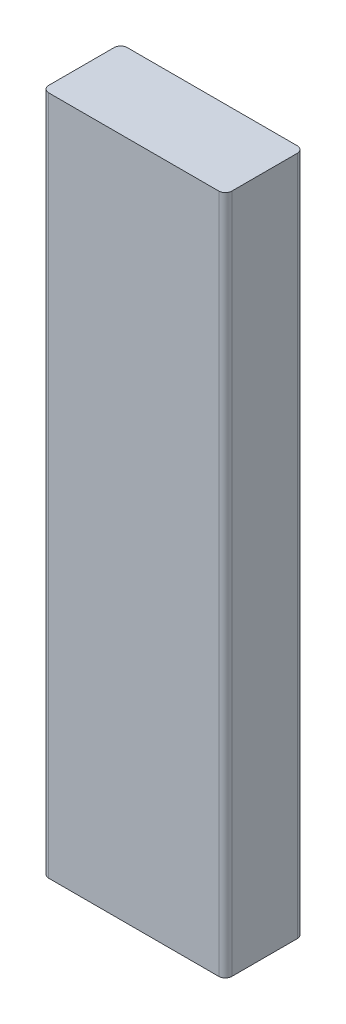
from build123d import *

# Parameters (mm, degrees)
BOSS_EXTRUDE1_DEPTH = 330.2


with BuildPart() as part:
    # Sketch1 → Boss-Extrude1 (new body)
    with BuildSketch(Plane(origin=(0, 0, 0), x_dir=(1, 0, 0), z_dir=(0, 1, 0))):
        with BuildLine():
            Line((41.275, -19.05), (-41.275, -19.05))
            ThreePointArc((-41.275, -19.05), (-43.52006403, -18.12006403), (-44.45, -15.875))
            Line((-44.45, -15.875), (-44.45, 15.875))
            ThreePointArc((-44.45, 15.875), (-43.52006403, 18.12006403), (-41.275, 19.05))
            Line((-41.275, 19.05), (41.275, 19.05))
            ThreePointArc((41.275, 19.05), (43.52006403, 18.12006403), (44.45, 15.875))
            Line((44.45, 15.875), (44.45, -15.875))
            ThreePointArc((44.45, -15.875), (43.52006403, -18.12006403), (41.275, -19.05))
        make_face()
    extrude(amount=BOSS_EXTRUDE1_DEPTH)


solid = part.part
